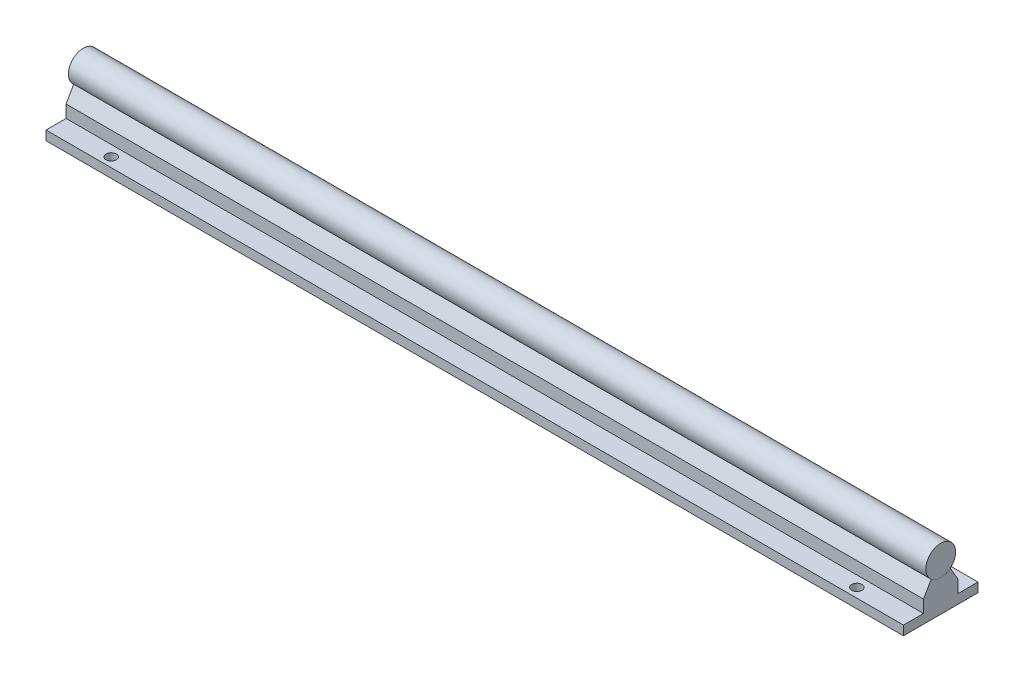
from build123d import *

# Parameters (mm, degrees)
SKETCH_3_R             = 8
EXTRUDE_341_DEPTH      = 460
EXTRUDE_741_DEPTH      = 460
SKETCH_5_R             = 2.75
CUT_EXTRUDE_1021_DEPTH = 462.285161261


with BuildPart() as part:
    # Эскиз3 → Extrude 341 (new body)
    with BuildSketch(Plane(origin=(0, 0, 0), x_dir=(0, 0, -1), z_dir=(1, 0, 0))):
        Circle(SKETCH_3_R)
    extrude(amount=EXTRUDE_341_DEPTH)


with BuildPart() as body_2:
    # Эскиз4 → Extrude 741 (new body)
    with BuildSketch(Plane(origin=(0, 0, 0), x_dir=(0, 0, -1), z_dir=(1, 0, 0))):
        with BuildLine():
            Line((-9.25, -20), (-9.25, -13.3))
            Line((-9.25, -13.3), (-5.1201439, -6.146879407))
            ThreePointArc((-5.1201439, -6.146879407), (0, -8), (5.1201439, -6.146879407))
            Line((5.1201439, -6.146879407), (9.25, -13.3))
            Line((9.25, -13.3), (9.25, -20))
            Line((9.25, -20), (20, -20))
            Line((20, -20), (20, -25))
            Line((20, -25), (-20, -25))
            Line((-20, -25), (-20, -20))
            Line((-20, -20), (-9.25, -20))
        make_face()
    extrude(amount=EXTRUDE_741_DEPTH)

    # Эскиз5 → Cut-Extrude 1021 (cut, through all)
    with BuildSketch(Plane(origin=(0, -20, 0), x_dir=(1, 0, 0), z_dir=(0, 1, 0))):
        with Locations((430, 15)):
            Circle(SKETCH_5_R)
        with Locations((430, -15)):
            Circle(SKETCH_5_R)
        with Locations((30, -15)):
            Circle(SKETCH_5_R)
        with Locations((30, 15)):
            Circle(SKETCH_5_R)
    extrude(amount=-CUT_EXTRUDE_1021_DEPTH, mode=Mode.SUBTRACT)


solid = Compound([part.part, body_2.part])
